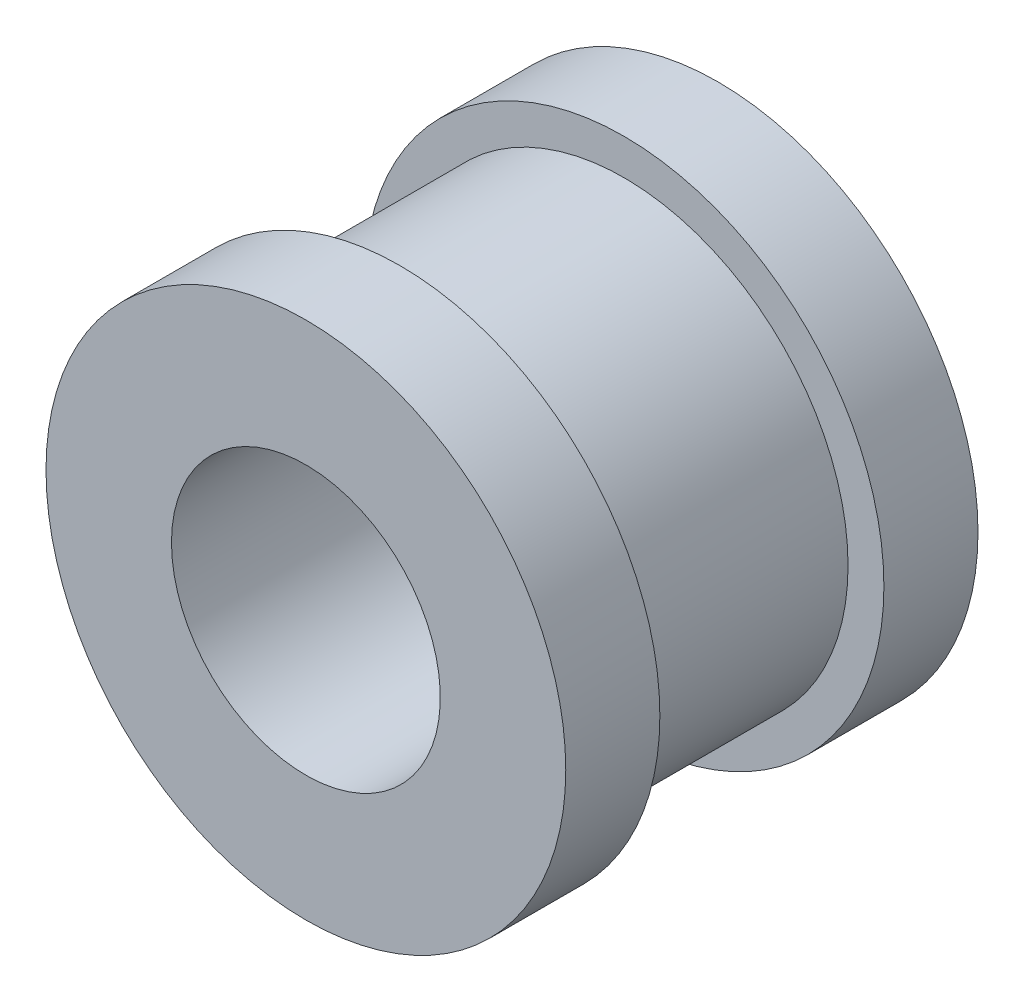
from build123d import *

# Parameters (mm, degrees)
SKETCH1_R           = 2.9
BOSS_EXTRUDE1_DEPTH = 1.05
SKETCH2_R           = 2.5
BOSS_EXTRUDE2_DEPTH = 2.5
SKETCH3_R           = 1.5
CUT_EXTRUDE1_DEPTH  = 4.6


with BuildPart() as part:
    # Sketch1 → Boss-Extrude1 (new body)
    with BuildSketch(Plane.XY):
        Circle(SKETCH1_R)
    boss_extrude1 = extrude(amount=BOSS_EXTRUDE1_DEPTH)

    # Sketch2 → Boss-Extrude2 (add)
    with BuildSketch(Plane.XY.offset(1.05)):
        Circle(SKETCH2_R)
    extrude(amount=BOSS_EXTRUDE2_DEPTH)

    # Mirror1: Boss-Extrude1 across plane
    add(boss_extrude1.mirror(Plane.XY.offset(2.3)))

    # Sketch3 → Cut-Extrude1 (cut)
    with BuildSketch(Plane(origin=(0, 0, 0), x_dir=(-1, 0, 0), z_dir=(0, 0, -1))):
        Circle(SKETCH3_R)
    extrude(amount=-CUT_EXTRUDE1_DEPTH, mode=Mode.SUBTRACT)


solid = part.part
